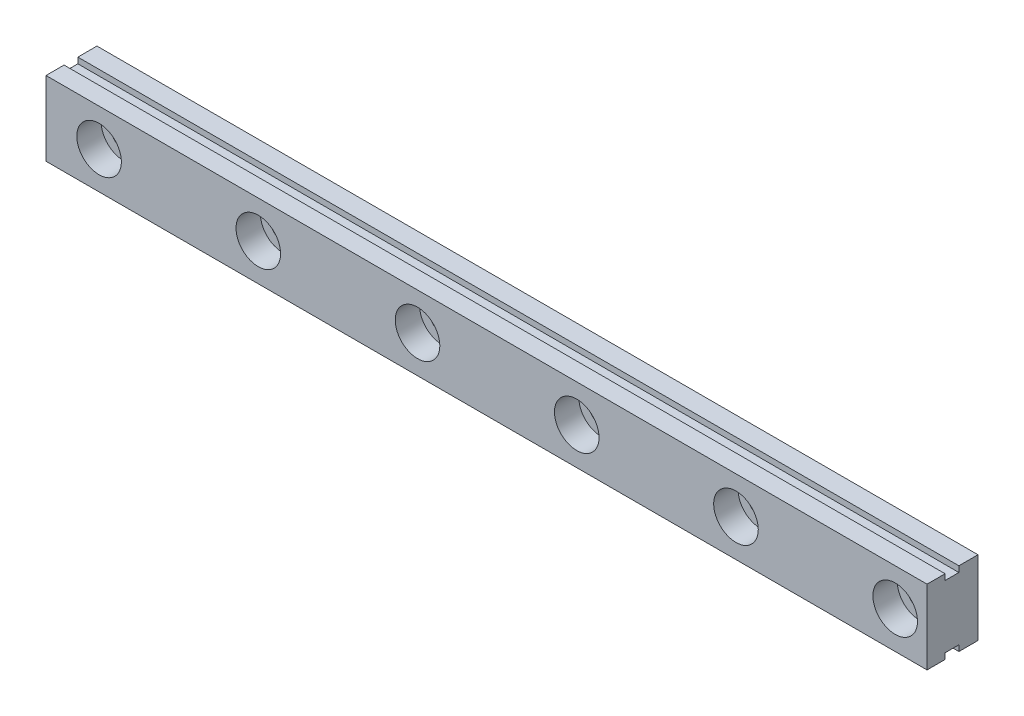
from build123d import *

# Parameters (mm, degrees)
F_100_START                                  = 32.4
F_100_MM_MGN7_RAIL_7_X_4_8_MM_PROFILE_W      = 100
F_100_MM_MGN7_RAIL_7_X_4_8_MM_PROFILE_H      = 7
F_100_MM_MGN7_RAIL_7_X_4_8_MM_DEPTH          = 4.8
NOMINAL_START                                = 34.2
NOMINAL_RACEWAY_CLEARANCE_PROFILE_W          = 100.2
NOMINAL_RACEWAY_CLEARANCE_PROFILE_H          = 1.05
NOMINAL_RACEWAY_CLEARANCE_DEPTH              = 1.3
SEVEN_START                                  = 32.3
SEVEN_RAIL_MOUNTING_HOLES_15_MM_PITCH_PR_R   = 1.2
SEVEN_RAIL_MOUNTING_HOLES_15_MM_PITCH_DEPTH  = 5
M2_START                                     = 34.9
M2_RAIL_BOLT_COUNTERBORES_DIAMETER_4_2_P_R   = 2.1
M2_RAIL_BOLT_COUNTERBORES_DIAMETER_4_2_DEPTH = 2.4
SKETCH_1_W                                   = 17
SKETCH_1_H                                   = 7
CUT_EXTRUDE_1_DEPTH                          = 10


with BuildPart() as part:
    # 100 mm MGN7 rail 7 x 4.8 mm profile → 100 mm MGN7 rail 7 x 4.8 mm (new body)
    with BuildSketch(Plane.XY.offset(F_100_START)):
        with Locations((33, 19)):
            Rectangle(F_100_MM_MGN7_RAIL_7_X_4_8_MM_PROFILE_W, F_100_MM_MGN7_RAIL_7_X_4_8_MM_PROFILE_H)
    extrude(amount=F_100_MM_MGN7_RAIL_7_X_4_8_MM_DEPTH)

    # Nominal raceway clearance profile → Nominal raceway clearance (cut)
    with BuildSketch(Plane.XY.offset(NOMINAL_START)):
        with Locations((33, 15.525)):
            Rectangle(NOMINAL_RACEWAY_CLEARANCE_PROFILE_W, NOMINAL_RACEWAY_CLEARANCE_PROFILE_H)
        with Locations((33, 22.475)):
            Rectangle(NOMINAL_RACEWAY_CLEARANCE_PROFILE_W, NOMINAL_RACEWAY_CLEARANCE_PROFILE_H)
    extrude(amount=NOMINAL_RACEWAY_CLEARANCE_DEPTH, mode=Mode.SUBTRACT)

    # Seven rail mounting holes 15 mm pitch profile → Seven rail mounting holes 15 mm pitch (cut)
    with BuildSketch(Plane.XY.offset(SEVEN_START)):
        with Locations((-12, 19)):
            Circle(SEVEN_RAIL_MOUNTING_HOLES_15_MM_PITCH_PR_R)
        with Locations((3, 19)):
            Circle(SEVEN_RAIL_MOUNTING_HOLES_15_MM_PITCH_PR_R)
        with Locations((18, 19)):
            Circle(SEVEN_RAIL_MOUNTING_HOLES_15_MM_PITCH_PR_R)
        with Locations((33, 19)):
            Circle(SEVEN_RAIL_MOUNTING_HOLES_15_MM_PITCH_PR_R)
        with Locations((48, 19)):
            Circle(SEVEN_RAIL_MOUNTING_HOLES_15_MM_PITCH_PR_R)
        with Locations((63, 19)):
            Circle(SEVEN_RAIL_MOUNTING_HOLES_15_MM_PITCH_PR_R)
        with Locations((78, 19)):
            Circle(SEVEN_RAIL_MOUNTING_HOLES_15_MM_PITCH_PR_R)
    extrude(amount=SEVEN_RAIL_MOUNTING_HOLES_15_MM_PITCH_DEPTH, mode=Mode.SUBTRACT)

    # M2 rail bolt counterbores diameter 4.2 profile → M2 rail bolt counterbores diameter 4.2 (cut)
    with BuildSketch(Plane.XY.offset(M2_START)):
        with Locations((-12, 19)):
            Circle(M2_RAIL_BOLT_COUNTERBORES_DIAMETER_4_2_P_R)
        with Locations((3, 19)):
            Circle(M2_RAIL_BOLT_COUNTERBORES_DIAMETER_4_2_P_R)
        with Locations((18, 19)):
            Circle(M2_RAIL_BOLT_COUNTERBORES_DIAMETER_4_2_P_R)
        with Locations((33, 19)):
            Circle(M2_RAIL_BOLT_COUNTERBORES_DIAMETER_4_2_P_R)
        with Locations((48, 19)):
            Circle(M2_RAIL_BOLT_COUNTERBORES_DIAMETER_4_2_P_R)
        with Locations((63, 19)):
            Circle(M2_RAIL_BOLT_COUNTERBORES_DIAMETER_4_2_P_R)
        with Locations((78, 19)):
            Circle(M2_RAIL_BOLT_COUNTERBORES_DIAMETER_4_2_P_R)
    extrude(amount=M2_RAIL_BOLT_COUNTERBORES_DIAMETER_4_2_DEPTH, mode=Mode.SUBTRACT)

    # 草图1 → 切除-拉伸1 (cut)
    with BuildSketch(Plane.XY.offset(37.2)):
        with Locations((74.5, 19)):
            Rectangle(SKETCH_1_W, SKETCH_1_H)
    extrude(amount=-CUT_EXTRUDE_1_DEPTH, mode=Mode.SUBTRACT)


solid = part.part
